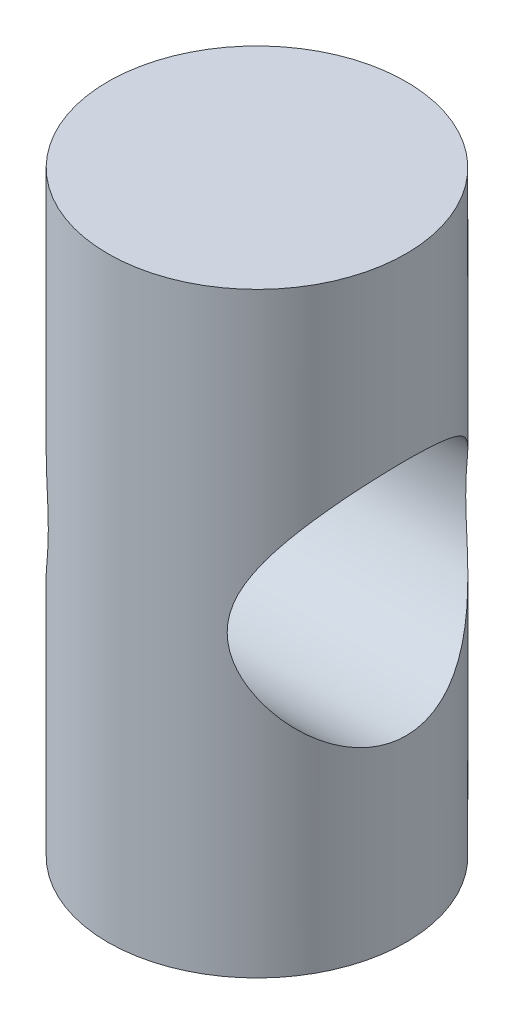
from build123d import *

# Parameters (mm, degrees)
SKETCH_1_R               = 5
EXTRUDE_1_DEPTH          = 20
CUT_EXTRUDE_1_DEPTH      = 22.213203436
CUT_EXTRUDE_1_DEPTH_BACK = 22.213203436
SKETCH_2_R               = 4


with BuildPart() as part:
    # 草图1 → 凸台-拉伸1 (new body)
    with BuildSketch(Plane(origin=(0, 0, 0), x_dir=(1, 0, 0), z_dir=(0, 1, 0))):
        with Locations(Location((0, 0, 0), (0, 0, 270))):
            Circle(SKETCH_1_R)
    extrude(amount=EXTRUDE_1_DEPTH)

    # 草图2 → 切除-拉伸1 (cut, two sides: drawn at the far end of the back side and taken through both)
    with BuildSketch(Plane(origin=(0, 0, 0), x_dir=(0, 0, -1), z_dir=(1, 0, 0)).offset(-CUT_EXTRUDE_1_DEPTH_BACK)):
        with Locations(Location((0, 10, 0), (0, 0, 180))):
            Circle(SKETCH_2_R)
    extrude(amount=CUT_EXTRUDE_1_DEPTH + CUT_EXTRUDE_1_DEPTH_BACK, mode=Mode.SUBTRACT)


solid = part.part
